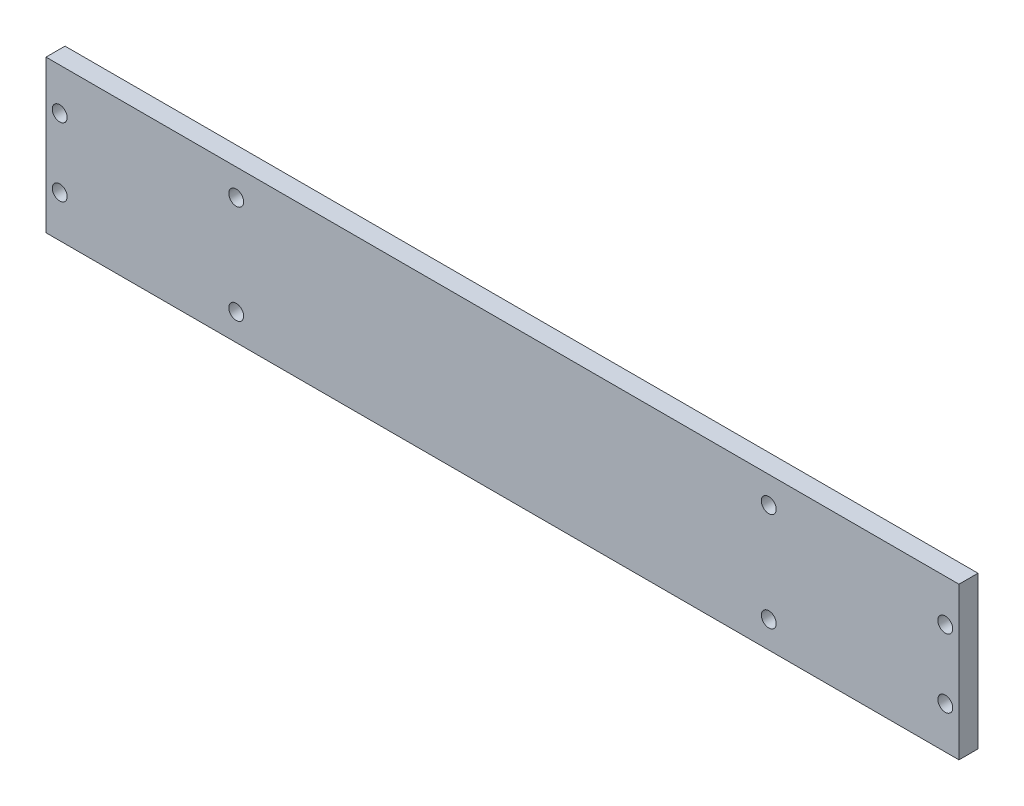
from build123d import *

# Parameters (mm, degrees)
SKETCH1_W           = 304.8
SKETCH1_H           = 50.8
SKETCH1_R           = 2.4892
BOSS_EXTRUDE1_DEPTH = 6.35


with BuildPart() as part:
    # Sketch1 → Boss-Extrude1 (new body)
    with BuildSketch(Plane.XY):
        Rectangle(SKETCH1_W, SKETCH1_H)
        with Locations((-88.9, 16.51)):
            Circle(SKETCH1_R, mode=Mode.SUBTRACT)
        with Locations((-88.9, -16.51)):
            Circle(SKETCH1_R, mode=Mode.SUBTRACT)
        with Locations((88.9, -16.51)):
            Circle(SKETCH1_R, mode=Mode.SUBTRACT)
        with Locations((88.9, 16.51)):
            Circle(SKETCH1_R, mode=Mode.SUBTRACT)
        with Locations((-147.828, 11.43)):
            Circle(SKETCH1_R, mode=Mode.SUBTRACT)
        with Locations((-147.828, -11.43)):
            Circle(SKETCH1_R, mode=Mode.SUBTRACT)
        with Locations((147.828, 11.43)):
            Circle(SKETCH1_R, mode=Mode.SUBTRACT)
        with Locations((147.828, -11.43)):
            Circle(SKETCH1_R, mode=Mode.SUBTRACT)
    extrude(amount=BOSS_EXTRUDE1_DEPTH)


solid = part.part
